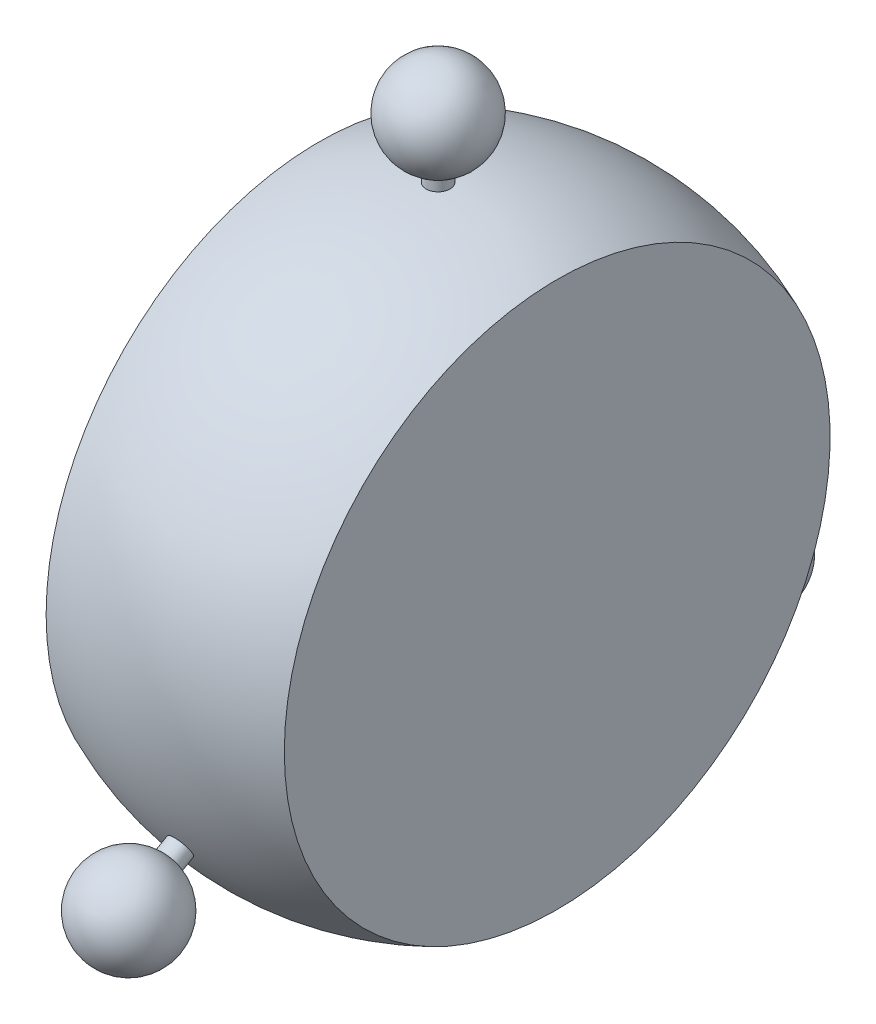
from build123d import *

# Parameters (mm, degrees)
MATRIZC1_COUNT = 3


with BuildPart() as part:
    # Croquis8 → Revolución4 (revolve)
    with BuildSketch(Plane.XY):
        with BuildLine():
            Line((-10, 22.912878475), (-10, 17.320508076))
            ThreePointArc((-10, 17.320508076), (-2.679491924, 10), (0, 0))
            Line((0, 0), (10, 0))
            Line((10, 0), (10, 22.912878475))
            ThreePointArc((10, 22.912878475), (0, 25), (-10, 22.912878475))
        make_face()
    revolve(axis=Axis((0, 0, 0), (1, 0, 0)))

    # Croquis3 → Revolución5 (revolve)
    with BuildSketch(Plane(origin=(0, 0, 0), x_dir=(0, 0, -1), z_dir=(1, 0, 0))):
        with BuildLine():
            Line((0, 25), (0, 34))
            ThreePointArc((0, 34), (3.968118785, 30.50401717), (1, 26.127016654))
            Line((1, 26.127016654), (1, 24.979991994))
            ThreePointArc((1, 24.979991994), (0.50010007, 24.994997498), (0, 25))
        make_face()
    revoluci_n5 = revolve(axis=Axis((0, 25, 0), (0, 1, 0)))

    # MatrizC1: Revolución5 ×3 about axis
    matrizc1_axis = Axis((0, 0, 0), (1, 0, 0))
    for i in range(1, MATRIZC1_COUNT):
        add(revoluci_n5.rotate(matrizc1_axis, i * 360 / MATRIZC1_COUNT))


solid = part.part
